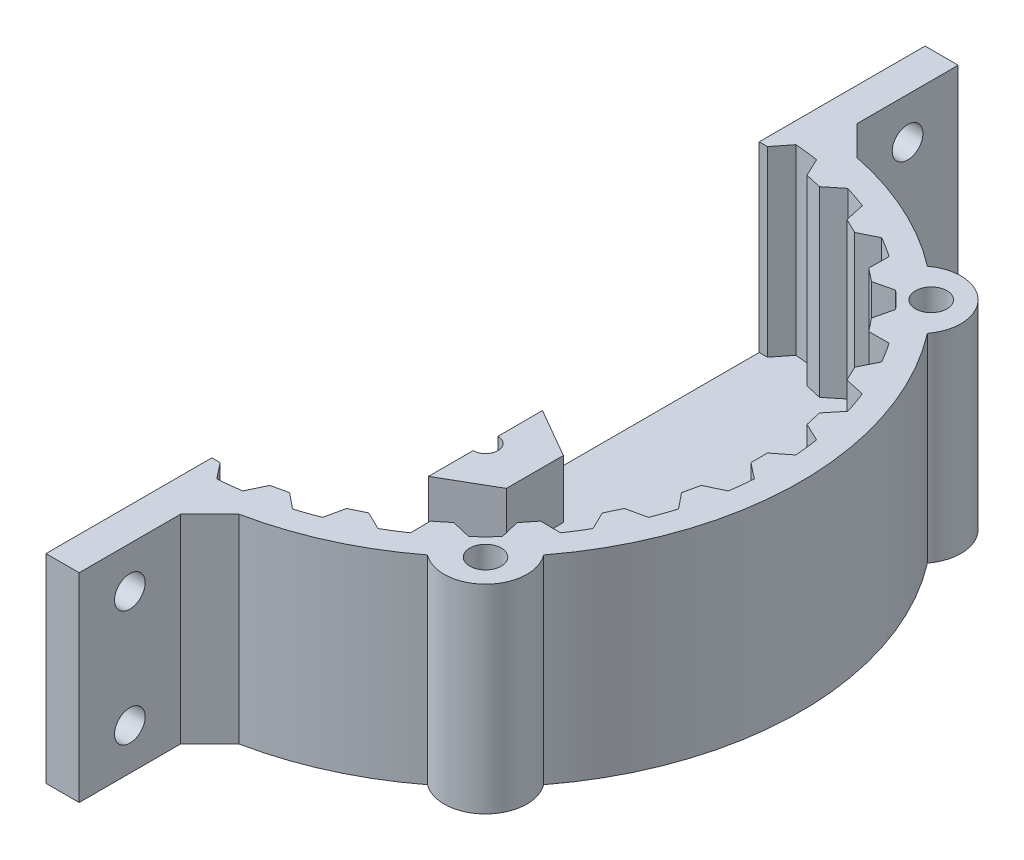
from build123d import *
from build123d.topology import SkipClean

# Parameters (mm, degrees)
SKETCH1_R            = 38
SKETCH1_R_2          = 35
SKETCH1_R_3          = 2
BOSS_EXTRUDE6_DEPTH  = 2
SKETCH1_7_R          = 38
SKETCH1_7_R_2        = 35
BOSS_EXTRUDE7_DEPTH  = 24
BOSS_EXTRUDE8_DEPTH  = 24
CIRPATTERN1_COUNT    = 28
BOSS_EXTRUDE9_DEPTH  = 24
SKETCH4_R            = 1.85
CUT_EXTRUDE2_DEPTH   = 4
BOSS_EXTRUDE12_DEPTH = 9
SKETCH7_R            = 1.5
CUT_EXTRUDE4_DEPTH   = 9
BOSS_EXTRUDE17_DEPTH = 24
SKETCH11_10_R        = 1.9
CUT_EXTRUDE7_DEPTH   = 24
CIRPATTERN2_COUNT    = 4
SKETCH5_W            = 41.086585788
SKETCH5_H            = 115.80999181
CUT_EXTRUDE3_DEPTH   = 24


with BuildPart() as part:
    # Sketch1 → Boss-Extrude6 (new body)
    # profile 1 of 5: a face of its own
    with BuildSketch(Plane(origin=(0, 0, 0), x_dir=(1, 0, 0), z_dir=(0, 1, 0))):
        with Locations(Location((0, 0, 0), (0, 0, 270))):
            Circle(SKETCH1_R)
        Circle(SKETCH1_R_2, mode=Mode.SUBTRACT)
    # profile 2 of 5: a face of its own
    with BuildSketch(Plane(origin=(0, 0, 0), x_dir=(1, 0, 0), z_dir=(0, 1, 0))):
        with BuildLine():
            Line((1, 33), (0, 33))
            Line((0, 33), (-1, 33))
            Line((-1, 33), (-2.5, 34.910600109))
            ThreePointArc((-2.5, 34.910600109), (-23.848480035, -25.617376915), (35, 0))
            ThreePointArc((35, 0), (25.617376915, 23.848480035), (2.5, 34.910600109))
            Line((2.5, 34.910600109), (1, 33))
        make_face()
        Circle(SKETCH1_R_3, mode=Mode.SUBTRACT)
    # profile 3 of 5: a face of its own
    with BuildSketch(Plane(origin=(0, 0, 0), x_dir=(1, 0, 0), z_dir=(0, 1, 0))):
        Circle(SKETCH1_R_3)
    # profile 4 of 5: a face of its own
    with BuildSketch(Plane(origin=(0, 0, 0), x_dir=(1, 0, 0), z_dir=(0, 1, 0))):
        with BuildLine():
            Line((0, 33), (0, 35))
            ThreePointArc((0, 35), (-1.250798979, 34.977642887), (-2.5, 34.910600109))
            Line((-2.5, 34.910600109), (-1, 33))
            Line((-1, 33), (0, 33))
        make_face()
    # profile 5 of 5: a face of its own
    with BuildSketch(Plane(origin=(0, 0, 0), x_dir=(1, 0, 0), z_dir=(0, 1, 0))):
        with BuildLine():
            ThreePointArc((2.5, 34.910600109), (1.250798979, 34.977642887), (0, 35))
            Line((0, 35), (0, 33))
            Line((0, 33), (1, 33))
            Line((1, 33), (2.5, 34.910600109))
        make_face()
    extrude(amount=BOSS_EXTRUDE6_DEPTH)

    # Sketch1<7> → Boss-Extrude7 (add)
    with BuildSketch(Plane(origin=(0, 0, 0), x_dir=(1, 0, 0), z_dir=(0, 1, 0))):
        with Locations(Location((0, 0, 0), (0, 0, 270))):
            Circle(SKETCH1_7_R)
        with Locations(Location((0, 0, 0), (0, 0, 270))):
            Circle(SKETCH1_7_R_2, mode=Mode.SUBTRACT)
    extrude(amount=BOSS_EXTRUDE7_DEPTH)

    # Sketch1<8> → Boss-Extrude8 (add)
    with BuildSketch(Plane(origin=(0, 0, 0), x_dir=(1, 0, 0), z_dir=(0, 1, 0))):
        with BuildLine():
            ThreePointArc((2.5, 34.910600109), (1.250798979, 34.977642887), (0, 35))
            Line((0, 35), (0, 33))
            Line((0, 33), (1, 33))
            Line((1, 33), (2.5, 34.910600109))
        make_face()
        with BuildLine():
            Line((0, 33), (0, 35))
            ThreePointArc((0, 35), (-1.250798979, 34.977642887), (-2.5, 34.910600109))
            Line((-2.5, 34.910600109), (-1, 33))
            Line((-1, 33), (0, 33))
        make_face()
    boss_extrude8 = extrude(amount=BOSS_EXTRUDE8_DEPTH)

    # CirPattern1: Boss-Extrude8 ×28 about axis
    cirpattern1_axis = Axis((0, 0, 0), (0, 1, 0))
    for i in range(1, CIRPATTERN1_COUNT):
        add(boss_extrude8.rotate(cirpattern1_axis, i * 360 / CIRPATTERN1_COUNT))

    # Sketch3 → Boss-Extrude9 (add)
    with BuildSketch(Plane(origin=(0, 0, 0), x_dir=(1, 0, 0), z_dir=(0, 1, 0))):
        with BuildLine():
            Line((0, -38), (0, -53))
            Line((0, -53), (4, -53))
            Line((4, -53), (4, -40.780878967))
            Line((4, -40.780878967), (7.535533906, -37.245345062))
            ThreePointArc((7.535533906, -37.245345062), (3.786613768, -37.810865583), (0, -38))
        make_face()
    boss_extrude9 = extrude(amount=BOSS_EXTRUDE9_DEPTH)

    # Sketch4 → Cut-Extrude2 (cut)
    with BuildSketch(Plane(origin=(0, 0, 0), x_dir=(0, 0, -1), z_dir=(1, 0, 0))):
        with Locations(Location((-46.890439484, 5, 0), (0, 0, 180))):
            Circle(SKETCH4_R)
        with Locations(Location((-46.890439484, 19, 0), (0, 0, 180))):
            Circle(SKETCH4_R)
    cut_extrude2 = extrude(amount=CUT_EXTRUDE2_DEPTH, mode=Mode.SUBTRACT)

    # Mirror1: Boss-Extrude9, Cut-Extrude2 across plane
    add(boss_extrude9.mirror(Plane.XY))
    add(cut_extrude2.mirror(Plane.XY), mode=Mode.SUBTRACT)

    # Sketch6 → Boss-Extrude12 (add)
    with BuildSketch(Plane(origin=(0, 0, 0), x_dir=(1, 0, 0), z_dir=(0, 1, 0))):
        Polygon((0, 6.870468203), (-5.95, 3.435234102), (-5.95, -3.435234102), (0, -6.870468203), (5.95, -3.435234102), (5.95, 3.435234102), align=None)
    extrude(amount=BOSS_EXTRUDE12_DEPTH)

    # Sketch7 → Cut-Extrude4 (cut)
    with BuildSketch(Plane(origin=(0, 0, 0), x_dir=(1, 0, 0), z_dir=(0, 1, 0))):
        with Locations(Location((0, 0, 0), (0, 0, 270))):
            Circle(SKETCH7_R)
    extrude(amount=CUT_EXTRUDE4_DEPTH, mode=Mode.SUBTRACT)

    # Sketch11 → Boss-Extrude17 (add)
    with BuildSketch(Plane(origin=(0, 0, 0), x_dir=(1, 0, 0), z_dir=(0, 1, 0))):
        with BuildLine():
            ThreePointArc((25.493387139, 28.179553087), (27.575155537, 28.634381073), (28.770057685, 26.870057685))
            ThreePointArc((28.770057685, 26.870057685), (28.61620219, 26.121072126), (28.179553087, 25.493387139))
            ThreePointArc((28.179553087, 25.493387139), (29.185469438, 24.335331798), (30.143828836, 23.137622676))
            ThreePointArc((30.143828836, 23.137622676), (29.69848481, 29.69848481), (23.137622676, 30.143828836))
            ThreePointArc((23.137622676, 30.143828836), (24.335331798, 29.185469438), (25.493387139, 28.179553087))
        make_face()
    boss_extrude17 = extrude(amount=BOSS_EXTRUDE17_DEPTH)

    # Sketch11<10> → Cut-Extrude7 (cut)
    with SkipClean():  # the faces are left unmerged after this step: merging them gives an invalid solid
        with BuildSketch(Plane(origin=(0, 0, 0), x_dir=(1, 0, 0), z_dir=(0, 1, 0))):
            with Locations(Location((26.870057685, 26.870057685, 0), (0, 0, 270))):
                Circle(SKETCH11_10_R)
        cut_extrude7 = extrude(amount=CUT_EXTRUDE7_DEPTH, mode=Mode.SUBTRACT)

    # CirPattern2: Boss-Extrude17, Cut-Extrude7 ×4 about axis
    with SkipClean():  # the faces are left unmerged after this step: merging them gives an invalid solid
        cirpattern2_axis = Axis((0, 0, 0), (0, 1, 0))
        add([boss_extrude17.rotate(cirpattern2_axis, i * 360 / CIRPATTERN2_COUNT) for i in range(1, CIRPATTERN2_COUNT)])
        add([cut_extrude7.rotate(cirpattern2_axis, i * 360 / CIRPATTERN2_COUNT) for i in range(1, CIRPATTERN2_COUNT)], mode=Mode.SUBTRACT)

    # Sketch5 → Cut-Extrude3 (cut)
    with SkipClean():  # the faces are left unmerged after this step: merging them gives an invalid solid
        with BuildSketch(Plane(origin=(0, 0, 0), x_dir=(1, 0, 0), z_dir=(0, 1, 0))):
            with Locations((-20.543292894, -1.918879007)):
                Rectangle(SKETCH5_W, SKETCH5_H)
        extrude(amount=CUT_EXTRUDE3_DEPTH, mode=Mode.SUBTRACT)


solid = part.part
